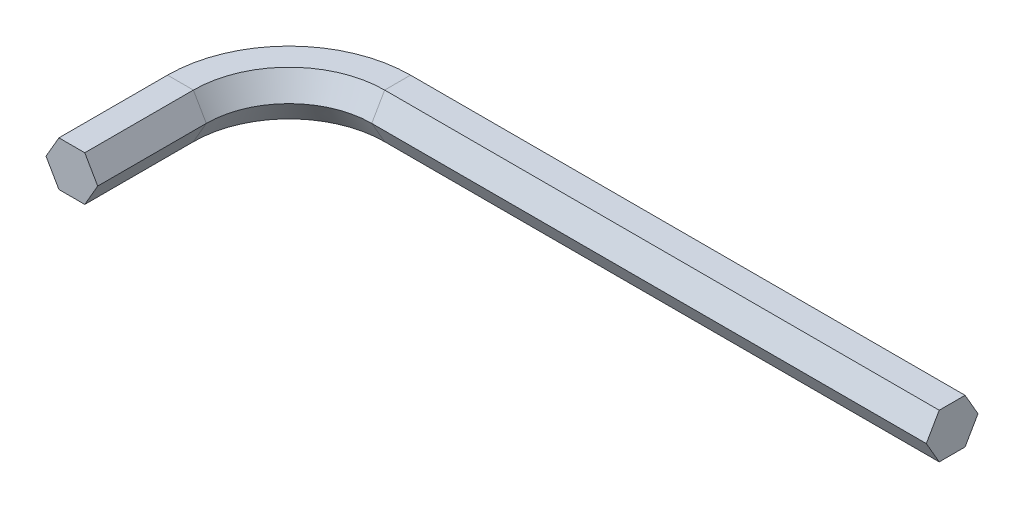
from build123d import *


with BuildPart() as part:
    # Sweep1: sweep along a path in Sketch2
    with BuildLine(Plane(origin=(0, 0, 0), x_dir=(1, 0, 0), z_dir=(0, 1, 0))) as sweep1_path:
        Line((0, 0), (0, 28))
        ThreePointArc((0, 28), (8.201010127, 47.798989873), (28, 56))
        Line((28, 56), (171, 56))
    # Sketch3 → Sweep1 (sweep)
    with BuildSketch(Plane.XY):
        Polygon((3.333333333, 5.773502692), (-3.333333333, 5.773502692), (-6.666666667, 0), (-3.333333333, -5.773502692), (3.333333333, -5.773502692), (6.666666667, 0), align=None)
    sweep(path=sweep1_path.line)


solid = part.part
